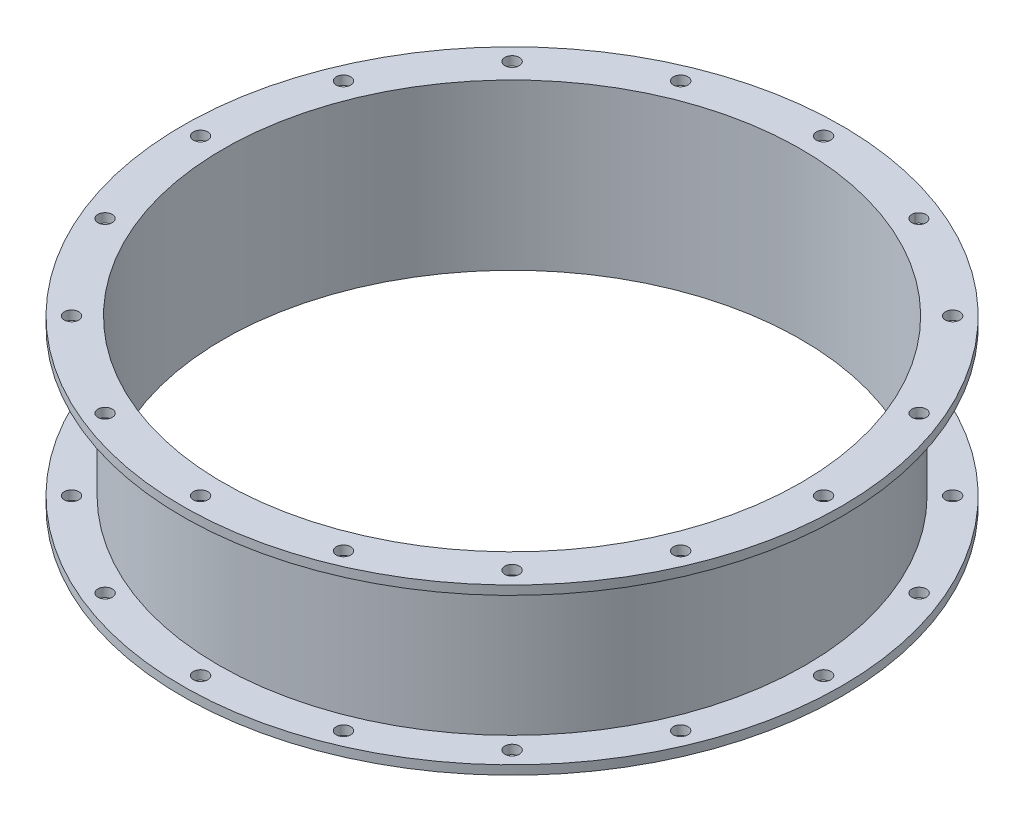
from build123d import *

# Parameters (mm, degrees)
CUT_EXTRUDE1_DEPTH      = 545.248334862
CUT_EXTRUDE1_DEPTH_BACK = 545.248334862
SKETCH2_R               = 8


with BuildPart() as part:
    # Sketch1 → Revolve1 (revolve)
    with BuildSketch(Plane.XY, mode=Mode.PRIVATE) as revolve1_sk:
        Polygon((-320, 586.81862199), (-320, 769.31862199), (-365, 769.31862199), (-365, 759.31862199), (-325, 759.31862199), (-325, 596.81862199), (-365, 596.81862199), (-365, 586.81862199), align=None)
    revolve(revolve1_sk.sketch.rotate(Axis((0, -8382.840526503, 0), (0, 1, 0)), 180), axis=Axis((0, -8382.840526503, 0), (0, 1, 0)))

    # Sketch2 → Cut-Extrude1 (cut, two sides: drawn at the far end of the back side and taken through both)
    with BuildSketch(Plane(origin=(0, 596.81862199, 0), x_dir=(1, 0, 0), z_dir=(0, 1, 0)).offset(-CUT_EXTRUDE1_DEPTH_BACK)):
        with Locations(Location((0, 345, 0), (0, 0, 180))):
            Circle(SKETCH2_R)
        with BuildLine():
            ThreePointArc((139.347363526, 315.514392242), (134.951947446, 325.802821793), (124.568900626, 321.635832007))
            ThreePointArc((124.568900626, 321.635832007), (128.964316707, 311.347402456), (139.347363526, 315.514392242))
        make_face()
        with Locations(Location((243.951839509, 243.951839509, 0), (0, 0, 180))):
            Circle(SKETCH2_R)
        with Locations(Location((318.738438716, 132.025784166, 0), (0, 0, 180))):
            Circle(SKETCH2_R)
        with Locations(Location((345, 0, 0), (0, 0, 180))):
            Circle(SKETCH2_R)
        with Locations(Location((318.738438716, -132.025784166, 0), (0, 0, 180))):
            Circle(SKETCH2_R)
        with Locations(Location((243.951839509, -243.951839509, 0), (0, 0, 180))):
            Circle(SKETCH2_R)
        with Locations(Location((132.025784166, -318.738438716, 0), (0, 0, 180))):
            Circle(SKETCH2_R)
        with Locations(Location((0, -345, 0), (0, 0, 180))):
            Circle(SKETCH2_R)
        with Locations(Location((-132.025784166, -318.738438716, 0), (0, 0, 180))):
            Circle(SKETCH2_R)
        with Locations(Location((-243.951839509, -243.951839509, 0), (0, 0, 180))):
            Circle(SKETCH2_R)
        with Locations(Location((-318.738438716, -132.025784166, 0), (0, 0, 180))):
            Circle(SKETCH2_R)
        with Locations(Location((-345, 0, 0), (0, 0, 180))):
            Circle(SKETCH2_R)
        with Locations(Location((-318.738438716, 132.025784166, 0), (0, 0, 180))):
            Circle(SKETCH2_R)
        with Locations(Location((-243.951839509, 243.951839509, 0), (0, 0, 180))):
            Circle(SKETCH2_R)
        with Locations(Location((-132.025784166, 318.738438716, 0), (0, 0, 180))):
            Circle(SKETCH2_R)
    extrude(amount=CUT_EXTRUDE1_DEPTH + CUT_EXTRUDE1_DEPTH_BACK, mode=Mode.SUBTRACT)


solid = part.part
